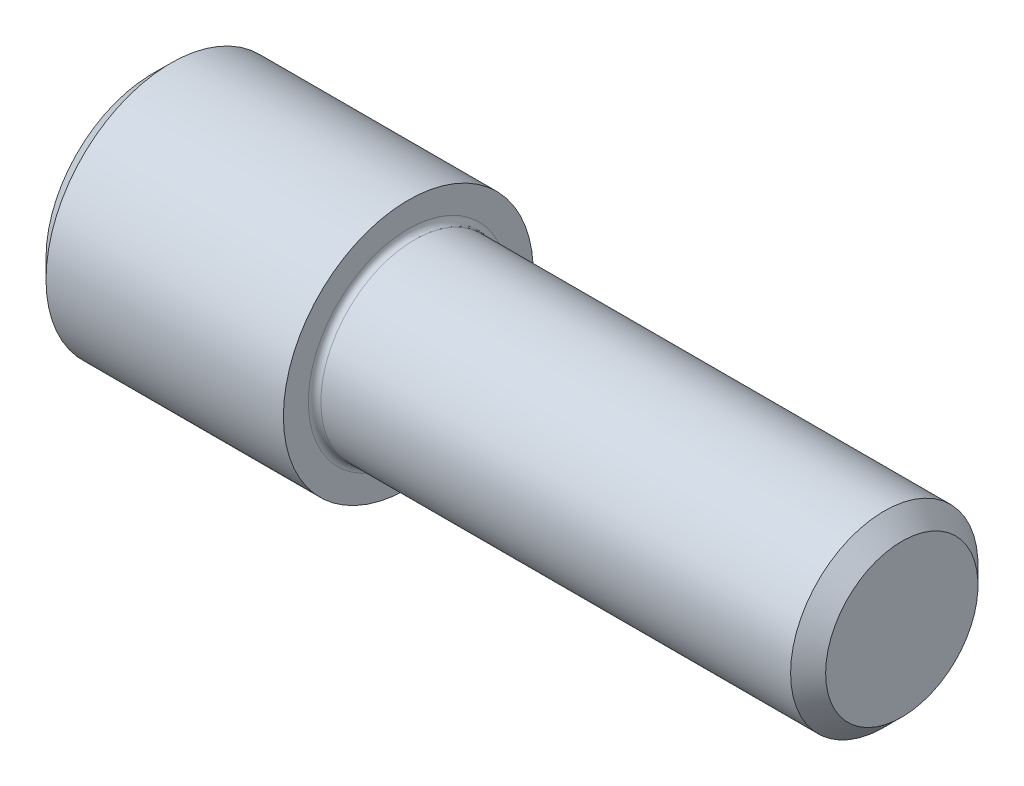
from build123d import *

# Parameters (mm, degrees)
FILLET1_R   = 0.1
HEX_2_DEPTH = 1.3


with BuildPart() as part:
    # BodySke → Base-Revolve (revolve)
    with BuildSketch(Plane.XY, mode=Mode.PRIVATE) as base_revolve_sk:
        Polygon((0, 0), (0, 1.7), (0.3, 2), (4.1, 2), (4.1, 1.5), (11.7195, 1.5), (12, 1.2195), (12, 0), align=None)
    revolve(base_revolve_sk.sketch.rotate(Axis((-31.75, 0, 0), (1, 0, 0)), 90), axis=Axis((-31.75, 0, 0), (1, 0, 0)))

    # Fillet1
    fillet1_edges = [part.edges().sort_by_distance(p)[0] for p in [
        (4.1, 0, -1.5),
    ]]
    fillet(fillet1_edges, radius=FILLET1_R)

    # Sketch2 → Hex-PreBroach (revolve, cut)
    with BuildSketch(Plane.XY, mode=Mode.PRIVATE) as hex_prebroach_sk:
        Polygon((0, 1.28), (1.3, 1.28), (2.039008345, 0), (0, 0), align=None)
    revolve(hex_prebroach_sk.sketch.rotate(Axis((0, 0, 0), (1, 0, 0)), 90), axis=Axis((0, 0, 0), (1, 0, 0)), mode=Mode.SUBTRACT)

    # Sketch3 → Hex 2 (cut)
    with BuildSketch(Plane(origin=(0, 0, 0), x_dir=(0, 0.500000000000001, 0.866025403784438), z_dir=(-1, 0, 0))):
        Polygon((0.739008345, 1.28), (-0.739008345, 1.28), (-1.478016689, 0), (-0.739008345, -1.28), (0.739008345, -1.28), (1.478016689, 0), align=None)
    extrude(amount=-HEX_2_DEPTH, mode=Mode.SUBTRACT)


solid = part.part
